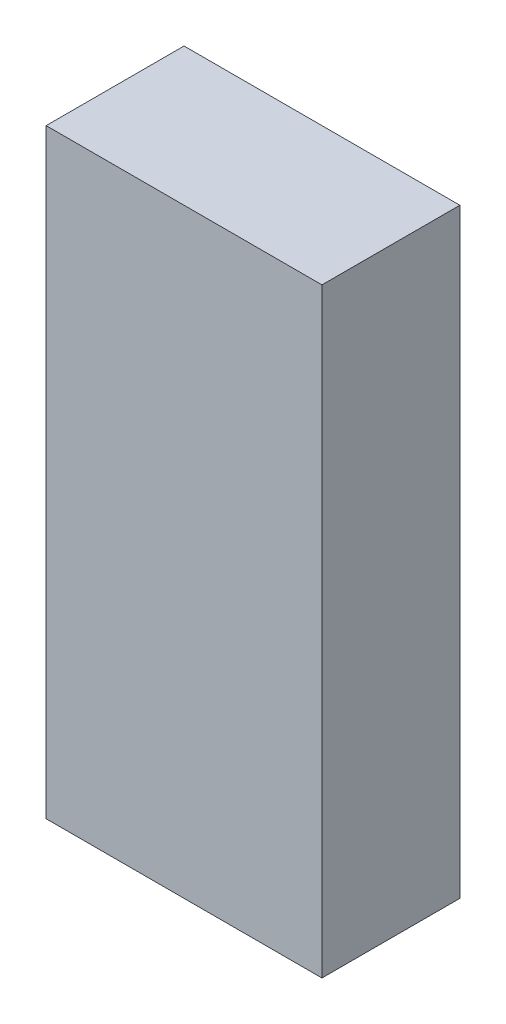
from build123d import *

# Parameters (mm, degrees)
SKETCH1_W           = 850
SKETCH1_H           = 1850
SKETCH1_W_2         = 250
SKETCH1_H_2         = 250
BOSS_EXTRUDE1_DEPTH = 400
SKETCH2_W           = 850
SKETCH2_H           = 1850
BOSS_EXTRUDE2_DEPTH = 25


with BuildPart() as part:
    # Sketch1 → Boss-Extrude1 (new body)
    with BuildSketch(Plane.XY):
        Rectangle(SKETCH1_W, SKETCH1_H)
        with Locations((275, 500)):
            Rectangle(SKETCH1_W_2, SKETCH1_H_2, mode=Mode.SUBTRACT)
        with Locations((275, 775)):
            Rectangle(SKETCH1_W_2, SKETCH1_H_2, mode=Mode.SUBTRACT)
        with Locations((0, 775)):
            Rectangle(SKETCH1_W_2, SKETCH1_H_2, mode=Mode.SUBTRACT)
        with Locations((-275, 775)):
            Rectangle(SKETCH1_W_2, SKETCH1_H_2, mode=Mode.SUBTRACT)
        with Locations((0, 500)):
            Rectangle(SKETCH1_W_2, SKETCH1_H_2, mode=Mode.SUBTRACT)
        with Locations((-275, 500)):
            Rectangle(SKETCH1_W_2, SKETCH1_H_2, mode=Mode.SUBTRACT)
        with Locations((275, 225)):
            Rectangle(SKETCH1_W_2, SKETCH1_H_2, mode=Mode.SUBTRACT)
        with Locations((0, 225)):
            Rectangle(SKETCH1_W_2, SKETCH1_H_2, mode=Mode.SUBTRACT)
        with Locations((-275, 225)):
            Rectangle(SKETCH1_W_2, SKETCH1_H_2, mode=Mode.SUBTRACT)
    extrude(amount=BOSS_EXTRUDE1_DEPTH)

    # Sketch2 → Boss-Extrude2 (add)
    with BuildSketch(Plane.XY.offset(400)):
        Rectangle(SKETCH2_W, SKETCH2_H)
    extrude(amount=BOSS_EXTRUDE2_DEPTH)


solid = part.part
